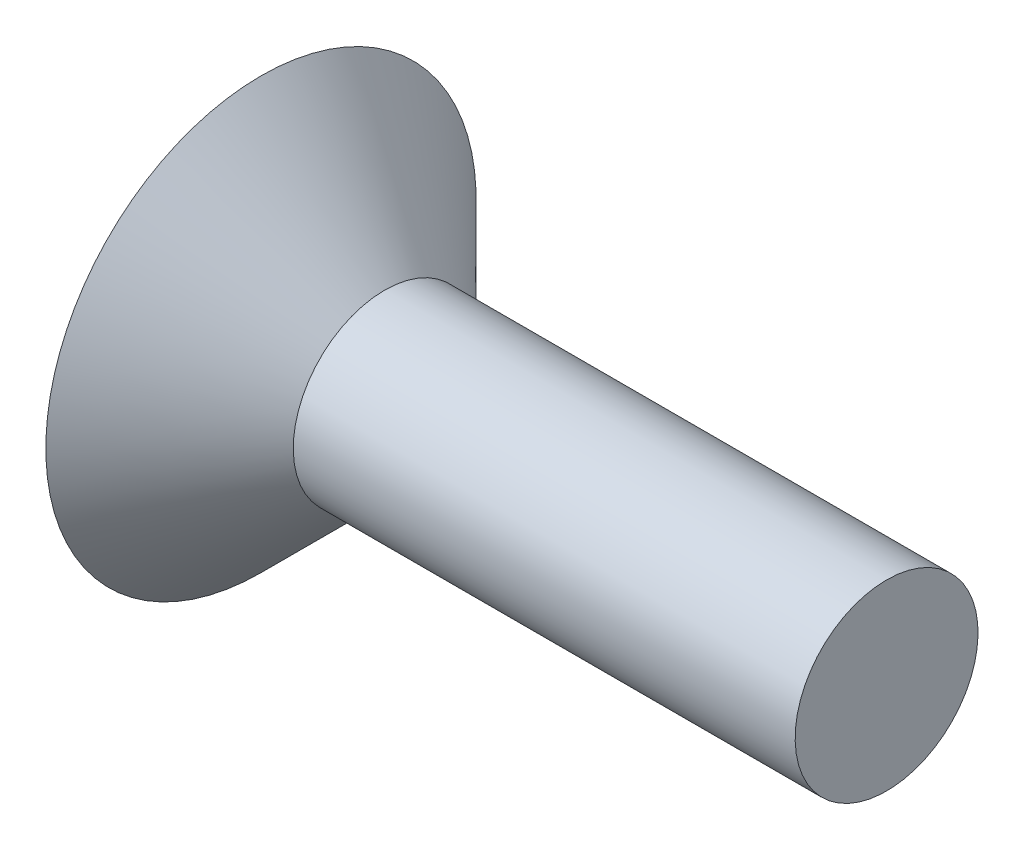
from build123d import *

# Parameters (mm, degrees)
KES_EKSTR_ZYON1_DEPTH = 1.5


with BuildPart() as part:
    # Çizim1 → Döndür1 (revolve)
    with BuildSketch(Plane.XY):
        Polygon((0, 0), (0, 4), (2.3, 1.7), (11.630773557, 1.7), (11.630773557, 0), align=None)
    revolve(axis=Axis((11.630773557, 0, 0), (-1, 0, 0)))

    # Çizim2 → Kes-Ekstrüzyon1 (cut)
    with BuildSketch(Plane.ZY):
        Polygon((1.154700538, -2), (2.309401077, 0), (1.154700538, 2), (-1.154700538, 2), (-2.309401077, 0), (-1.154700538, -2), align=None)
    extrude(amount=-KES_EKSTR_ZYON1_DEPTH, mode=Mode.SUBTRACT)


solid = part.part
